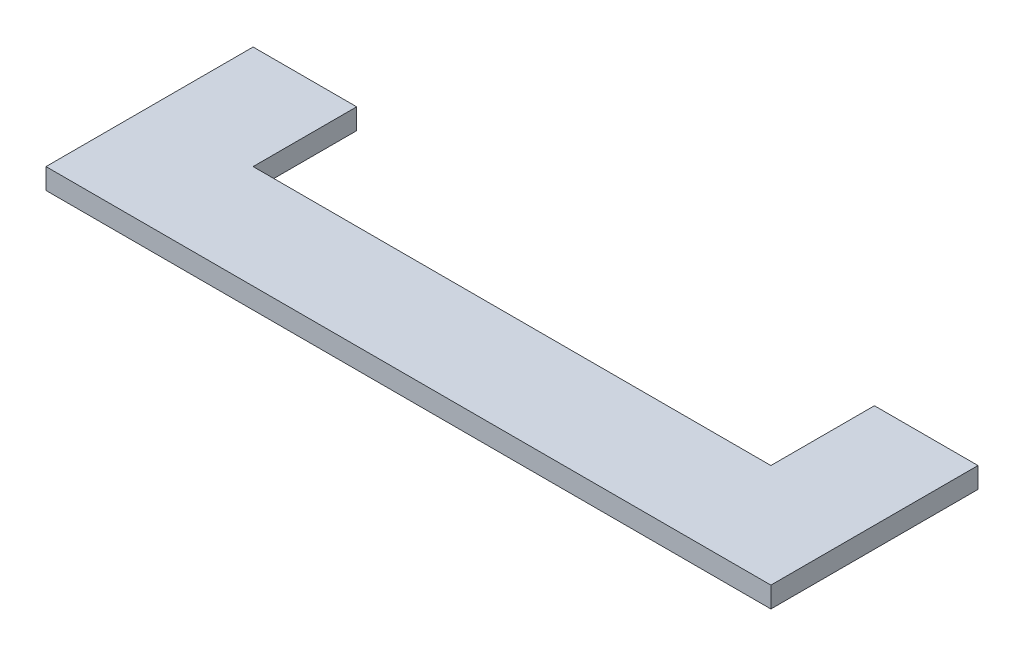
from build123d import *

# Parameters (mm, degrees)
BOSS_EXTRUDE1_DEPTH = 6


with BuildPart() as part:
    # Sketch1 → Boss-Extrude1 (new body)
    with BuildSketch(Plane(origin=(0, 0, 0), x_dir=(1, 0, 0), z_dir=(0, 1, 0))):
        Polygon((-75, -49), (-105, -49), (-105, -109), (105, -109), (105, -49), (75, -49), (75, -79), (-75, -79), align=None)
    extrude(amount=BOSS_EXTRUDE1_DEPTH)


solid = part.part
